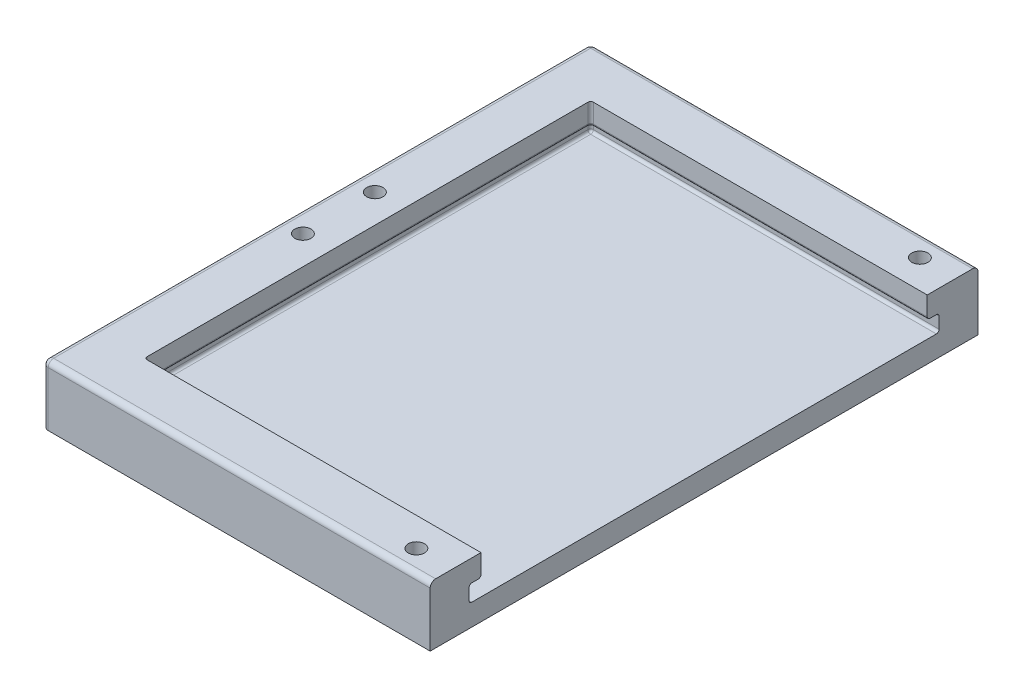
from build123d import *

# Parameters (mm, degrees)
SKETCH1_W           = 71.7
SKETCH1_H           = 101.4
BOSS_EXTRUDE1_DEPTH = 11.1
CUT_EXTRUDE1_DEPTH  = 62.3
SKETCH6_W           = 87
SKETCH6_H           = 3.1
CUT_EXTRUDE2_DEPTH  = 2.2
FILLET1_R           = 0.5
FILLET2_R           = 1
SKETCH7_R           = 1.5
CUT_EXTRUDE3_DEPTH  = 4
SKETCH8_R           = 1.5
CUT_EXTRUDE4_DEPTH  = 4


with BuildPart() as part:
    # Sketch1 → Boss-Extrude1 (new body)
    with BuildSketch(Plane(origin=(0, 0, 0), x_dir=(1, 0, 0), z_dir=(0, 1, 0))):
        Rectangle(SKETCH1_W, SKETCH1_H)
    extrude(amount=BOSS_EXTRUDE1_DEPTH)

    # Sketch5 → Cut-Extrude1 (cut)
    with BuildSketch(Plane(origin=(35.85, 0, 0), x_dir=(0, 0, -1), z_dir=(1, 0, 0))):
        Polygon((-41.3, 18.36393321), (-41.3, 7.1), (-43.5, 7.1), (-43.5, 4), (43.5, 4), (43.5, 7.1), (41.3, 7.1), (41.3, 18.36393321), align=None)
    extrude(amount=-CUT_EXTRUDE1_DEPTH, mode=Mode.SUBTRACT)

    # Sketch6 → Cut-Extrude2 (cut)
    with BuildSketch(Plane(origin=(-26.45, 0, 0), x_dir=(0, 0, -1), z_dir=(1, 0, 0))):
        with Locations((0, 5.55)):
            Rectangle(SKETCH6_W, SKETCH6_H)
    extrude(amount=-CUT_EXTRUDE2_DEPTH, mode=Mode.SUBTRACT)

    # Fillet1
    fillet1_edges = [part.edges().sort_by_distance(p)[0] for p in [
        (-26.45, 9.1, -41.3),
        (4.7, 7.1, -41.3),
        (3.6, 7.1, -43.5),
        (3.6, 4, -43.5),
        (3.6, 4, 43.5),
        (3.6, 7.1, 43.5),
        (-26.45, 9.1, 41.3),
        (4.7, 7.1, 41.3),
        (-26.45, 7.1, 0),
        (-28.65, 7.1, 0),
        (-28.65, 5.55, -43.5),
        (-28.65, 4, 0),
        (-28.65, 5.55, 43.5),
    ]]
    fillet(fillet1_edges, radius=FILLET1_R)

    # Fillet2
    fillet2_edges = [part.edges().sort_by_distance(p)[0] for p in [
        (0, 11.1, -50.7),
        (-35.85, 11.1, 0),
        (0, 11.1, 50.7),
        (-35.85, 5.55, -50.7),
        (-35.85, 5.55, 50.7),
    ]]
    fillet(fillet2_edges, radius=FILLET2_R)

    # Sketch7 → Cut-Extrude3 (cut)
    with BuildSketch(Plane(origin=(0, 11.1, 0), x_dir=(1, 0, 0), z_dir=(0, 1, 0))):
        with Locations(Location((-31.75, -6.65790951, 0), (0, 0, 270))):
            Circle(SKETCH7_R)
        with Locations(Location((-31.75, 6.65790951, 0), (0, 0, 90))):
            Circle(SKETCH7_R)
    extrude(amount=-CUT_EXTRUDE3_DEPTH, mode=Mode.SUBTRACT)

    # Sketch8 → Cut-Extrude4 (cut)
    with BuildSketch(Plane(origin=(0, 11.1, 0), x_dir=(1, 0, 0), z_dir=(0, 1, 0))):
        with Locations(Location((29.19209049, -46.6, 0), (0, 0, 270))):
            Circle(SKETCH8_R)
        with Locations(Location((29.19209049, 46.6, 0), (0, 0, 270))):
            Circle(SKETCH8_R)
    extrude(amount=-CUT_EXTRUDE4_DEPTH, mode=Mode.SUBTRACT)


solid = part.part
